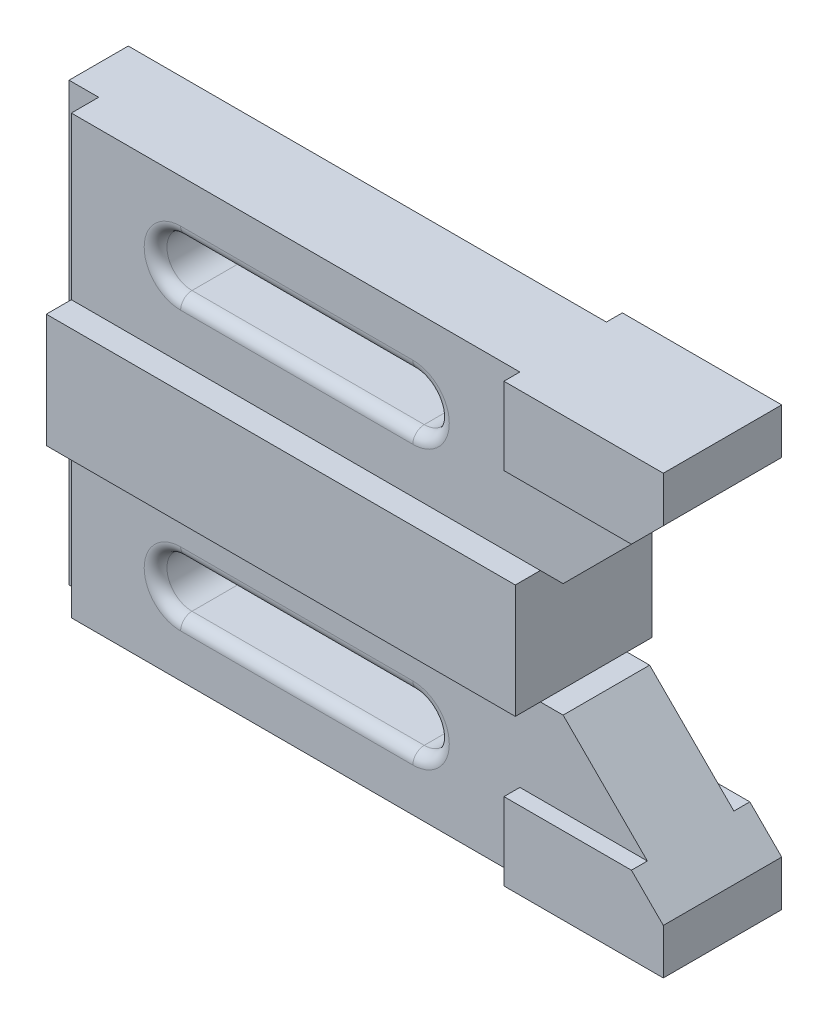
from build123d import *

# Parameters (mm, degrees)
SKETCH2_W               = 109.5
SKETCH2_H               = 12.5
BOSS_EXTRUDE1_DEPTH     = 15
BOSS_EXTRUDE2_DEPTH     = 9.5
BOSS_EXTRUDE3_DEPTH     = 13
CUT_EXTRUDE2_DEPTH      = 149.758193052
CUT_EXTRUDE2_DEPTH_BACK = 149.758193052
FILLET2_R               = 2.5


with BuildPart() as part:
    # Sketch2 → Boss-Extrude1 (new, symmetric)
    with BuildSketch(Plane.XY):
        with Locations((54.75, 6.25)):
            Rectangle(SKETCH2_W, SKETCH2_H)
    extrude(amount=BOSS_EXTRUDE1_DEPTH, both=True)

    # Sketch2<3> → Boss-Extrude2 (add, symmetric)
    with BuildSketch(Plane.XY):
        Polygon((0, 48), (0, 12.5), (109.5, 12.5), (114.5, 12.5), (133, 31), (105, 31), (105, 48), align=None)
        with BuildLine():
            ThreePointArc((30.5, 25), (25, 30.5), (30.5, 36))
            Line((30.5, 36), (81.5, 36))
            ThreePointArc((81.5, 36), (87, 30.5), (81.5, 25))
            Line((81.5, 25), (30.5, 25))
        make_face(mode=Mode.SUBTRACT)
    extrude(amount=BOSS_EXTRUDE2_DEPTH, both=True)

    # Sketch2<4> → Boss-Extrude3 (add, symmetric)
    with BuildSketch(Plane.XY):
        Polygon((140, 48), (105, 48), (105, 31), (133, 31), (140, 38), align=None)
    extrude(amount=BOSS_EXTRUDE3_DEPTH, both=True)

    # Sketch3 → Cut-Extrude2 (cut, two sides: drawn at the far end of the back side and taken through both)
    with BuildSketch(Plane(origin=(0, 48, 0), x_dir=(1, 0, 0), z_dir=(0, 1, 0)).offset(-CUT_EXTRUDE2_DEPTH_BACK)):
        Polygon((-292.434063101, -3.5), (0, -3.5), (6.5, -3.5), (6.5, -15), (6.5, -307.434063101), (-410.479849846, -717.554203878), (-709.413912948, -413.620140776), align=None)
    extrude(amount=CUT_EXTRUDE2_DEPTH + CUT_EXTRUDE2_DEPTH_BACK, mode=Mode.SUBTRACT)

    # Fillet2
    fillet2_edges = [part.edges().sort_by_distance(p)[0] for p in [
        (25, 30.5, 9.5),
        (56, 25, 9.5),
        (87, 30.5, 9.5),
        (56, 36, 9.5),
    ]]
    fillet(fillet2_edges, radius=FILLET2_R)

    # Mirror3: part across plane


with BuildPart() as part_1:
    add(part.part)
    add(part.part.mirror(Plane(origin=(0, 0, 15), x_dir=(0, 0, 1), z_dir=(0, -1, 0))))


solid = part_1.part
